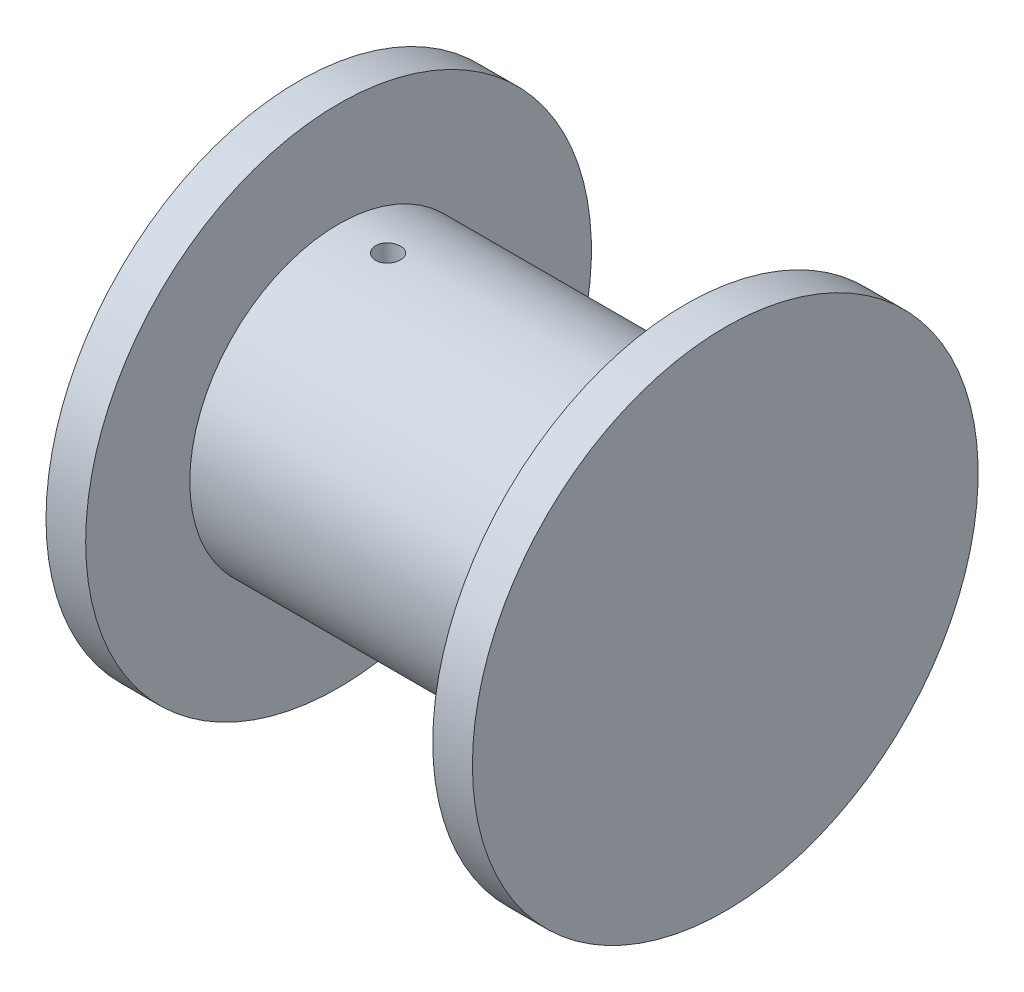
from build123d import *

# Parameters (mm, degrees)
SKETCH7_W          = 1.25
SKETCH7_H          = 15
CUT_EXTRUDE1_DEPTH = 12


with BuildPart() as part:
    # Sketch1 → Revolve1 (revolve)
    with BuildSketch(Plane.XY, mode=Mode.PRIVATE) as revolve1_sk:
        Polygon((0, 0), (0, 3), (0, 25.5), (4, 25.5), (4, 15), (39, 15), (39, 25.5), (43, 25.5), (43, 3), (43, 0), align=None)
    revolve(revolve1_sk.sketch.rotate(Axis((0, 0, 0), (1, 0, 0)), 90), axis=Axis((0, 0, 0), (1, 0, 0)))

    # Sketch7 → M3 Tapped Hole1 (revolve, cut)
    with BuildSketch(Plane(origin=(9, 0, 0), x_dir=(0, 0, -1), z_dir=(1, 0, 0))):
        with Locations((0.625, 7.5)):
            Rectangle(SKETCH7_W, SKETCH7_H)
    revolve(axis=Axis((9, -6.35, 0), (0, 1, 0)), mode=Mode.SUBTRACT)

    # Sketch8 → Cut-Extrude1 (cut)
    with BuildSketch(Plane.ZY):
        with BuildLine():
            Line((-1.658312395, 2.5), (1.658312395, 2.5))
            ThreePointArc((1.658312395, 2.5), (0, -3), (-1.658312395, 2.5))
        make_face()
    extrude(amount=-CUT_EXTRUDE1_DEPTH, mode=Mode.SUBTRACT)


solid = part.part
